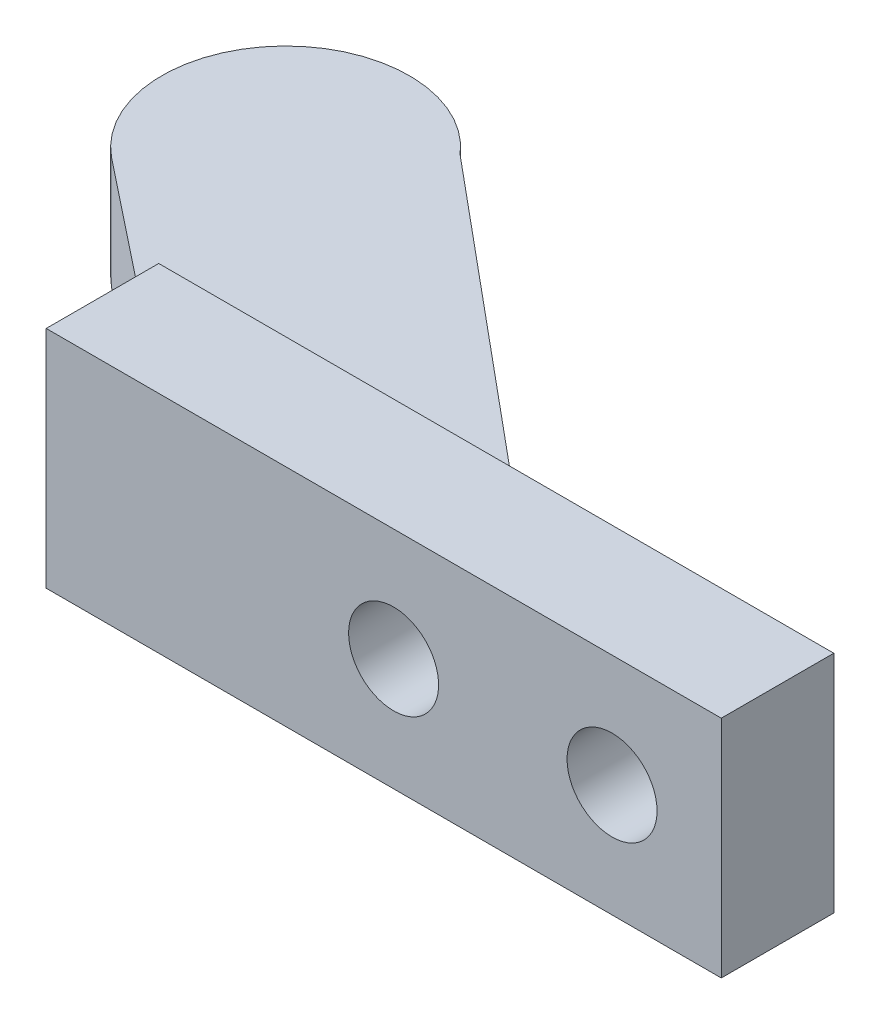
from build123d import *

# Parameters (mm, degrees)
BOSS_EXTRUDE1_DEPTH = 5
SKETCH1_3_R         = 2.6
BOSS_EXTRUDE2_DEPTH = 5
CHAMFER1_SIZE       = 0.5
SKETCH1_4_R         = 2.6
BOSS_EXTRUDE3_DEPTH = 5
BOSS_EXTRUDE5_DEPTH = 5
FILLET1_R           = 1
BOSS_EXTRUDE6_DEPTH = 10
SKETCH6_R           = 2
CUT_EXTRUDE2_DEPTH  = 28.229379267
CUT_EXTRUDE3_DEPTH  = 5
FILLET2_R           = 2


with BuildPart() as part:
    # Sketch1 → Boss-Extrude1 (new body)
    with BuildSketch(Plane(origin=(0, 0, 0), x_dir=(1, 0, 0), z_dir=(0, 1, 0))):
        with BuildLine():
            Line((-8.145959292, -19.953256743), (21.854040708, -19.953256743))
            Line((21.854040708, -19.953256743), (21.854040708, -14.953256743))
            Line((21.854040708, -14.953256743), (2.437414378, -14.953256743))
            Line((2.437414378, -14.953256743), (-10.632140568, -4.07312727))
            ThreePointArc((-10.632140568, -4.07312727), (-18.751087195, -3.819561463), (-18.267994591, -11.928088548))
            Line((-18.267994591, -11.928088548), (-8.145959292, -19.953256743))
        make_face()
    extrude(amount=BOSS_EXTRUDE1_DEPTH)

    # Sketch1<3> → Boss-Extrude2 (add)
    with BuildSketch(Plane(origin=(0, 0, 0), x_dir=(1, 0, 0), z_dir=(0, 1, 0))):
        with Locations((-14.807385825, -7.653256743)):
            Circle(SKETCH1_3_R)
    extrude(amount=-BOSS_EXTRUDE2_DEPTH)

    # Chamfer1
    chamfer1_edges = [part.edges().sort_by_distance(p)[0] for p in [
        (-17.407385825, -5, 7.653256743),
    ]]
    chamfer(chamfer1_edges, length=CHAMFER1_SIZE)

    # Sketch1<4> → Boss-Extrude3 (add)
    with BuildSketch(Plane(origin=(0, 0, 0), x_dir=(1, 0, 0), z_dir=(0, 1, 0))):
        with BuildLine():
            Line((-8.145959292, -19.953256743), (21.854040708, -19.953256743))
            Line((21.854040708, -19.953256743), (21.854040708, -16.953256743))
            Line((21.854040708, -16.953256743), (21.854040708, -14.953256743))
            Line((21.854040708, -14.953256743), (2.437414378, -14.953256743))
            Line((2.437414378, -14.953256743), (-10.632140568, -4.07312727))
            ThreePointArc((-10.632140568, -4.07312727), (-18.751087195, -3.819561463), (-18.267994591, -11.928088548))
            Line((-18.267994591, -11.928088548), (-8.145959292, -19.953256743))
        make_face()
        with Locations((-14.807385825, -7.653256743)):
            Circle(SKETCH1_4_R, mode=Mode.SUBTRACT)
    extrude(amount=BOSS_EXTRUDE3_DEPTH)

    # Sketch5 → Boss-Extrude5 (add)
    with BuildSketch(Plane(origin=(0, 5, 0), x_dir=(1, 0, 0), z_dir=(0, 1, 0))):
        Polygon((-8.145959292, -14.953256743), (-14.452391166, -14.953256743), (-8.145959292, -19.953256743), (21.854040708, -19.953256743), (21.854040708, -14.953256743), align=None)
    extrude(amount=BOSS_EXTRUDE5_DEPTH)

    # Fillet1
    fillet1_edges = [part.edges().sort_by_distance(p)[0] for p in [
        (-17.407385825, 0, 7.653256743),
    ]]
    fillet(fillet1_edges, radius=FILLET1_R)

    # Sketch7 → Boss-Extrude6 (add)
    with BuildSketch(Plane(origin=(0, 10, 0), x_dir=(1, 0, 0), z_dir=(0, 1, 0))):
        Polygon((21.854040708, -24.953256743), (21.854040708, -19.953256743), (-8.145959292, -19.953256743), (-8.145959292, -24.953256743), (-6.634863272, -24.953256743), align=None)
    extrude(amount=-BOSS_EXTRUDE6_DEPTH)

    # Sketch6 → Cut-Extrude2 (cut, through all)
    with BuildSketch(Plane(origin=(0, 0, 14.953256743), x_dir=(-1, 0, 0), z_dir=(0, 0, -1))):
        with Locations((-7.291570961, 5)):
            Circle(SKETCH6_R)
        with Locations((-16.999884126, 5)):
            Circle(SKETCH6_R)
    extrude(amount=-CUT_EXTRUDE2_DEPTH, mode=Mode.SUBTRACT)

    # Sketch8 → Cut-Extrude3 (cut)
    with BuildSketch(Plane(origin=(0, 0, 14.953256743), x_dir=(-1, 0, 0), z_dir=(0, 0, -1))):
        Polygon((-21.854040708, 0), (-2.437414378, 0), (-2.437414378, 5), (14.452391166, 5), (14.452391166, 10), (-21.854040708, 10), align=None)
    extrude(amount=-CUT_EXTRUDE3_DEPTH, mode=Mode.SUBTRACT)

    # Fillet2
    fillet2_edges = [part.edges().sort_by_distance(p)[0] for p in [
        (-2.854272457, 5, 19.953256743),
    ]]
    fillet(fillet2_edges, radius=FILLET2_R)


solid = part.part
